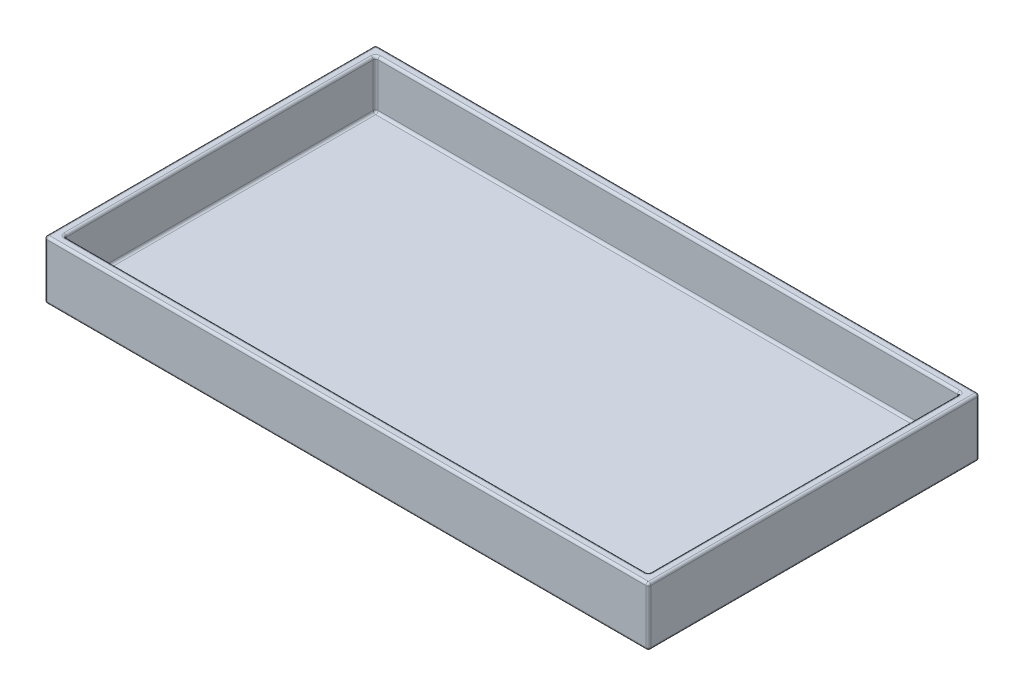
from build123d import *

# Parameters (mm, degrees)
SKETCH1_W           = 124
SKETCH1_H           = 68
BOSS_EXTRUDE1_DEPTH = 12
SKETCH2_W           = 120
SKETCH2_H           = 64
CUT_EXTRUDE1_DEPTH  = 10
FILLET1_R           = 0.5


with BuildPart() as part:
    # Sketch1 → Boss-Extrude1 (new body)
    with BuildSketch(Plane(origin=(0, 0, 0), x_dir=(1, 0, 0), z_dir=(0, 1, 0))):
        with Locations((62, 34)):
            Rectangle(SKETCH1_W, SKETCH1_H)
    extrude(amount=BOSS_EXTRUDE1_DEPTH)

    # Sketch2 → Cut-Extrude1 (cut)
    with BuildSketch(Plane(origin=(0, 12, 0), x_dir=(1, 0, 0), z_dir=(0, 1, 0))):
        with Locations((62, 34)):
            Rectangle(SKETCH2_W, SKETCH2_H)
    extrude(amount=-CUT_EXTRUDE1_DEPTH, mode=Mode.SUBTRACT)

    # Fillet1
    fillet1_edges = [part.edges().sort_by_distance(p)[0] for p in [
        (124, 12, -34),
        (62, 12, -68),
        (62, 2, -66),
        (2, 7, -66),
        (122, 2, -34),
        (122, 7, -66),
        (62, 2, -2),
        (122, 7, -2),
        (2, 2, -34),
        (2, 7, -2),
        (62, 12, -66),
        (2, 12, -34),
        (62, 12, -2),
        (122, 12, -34),
        (0, 12, -34),
        (62, 0, -68),
        (124, 0, -34),
        (62, 0, 0),
        (0, 0, -34),
        (62, 12, 0),
        (0, 6, -68),
        (124, 6, -68),
        (124, 6, 0),
        (0, 6, 0),
    ]]
    fillet(fillet1_edges, radius=FILLET1_R)


solid = part.part
